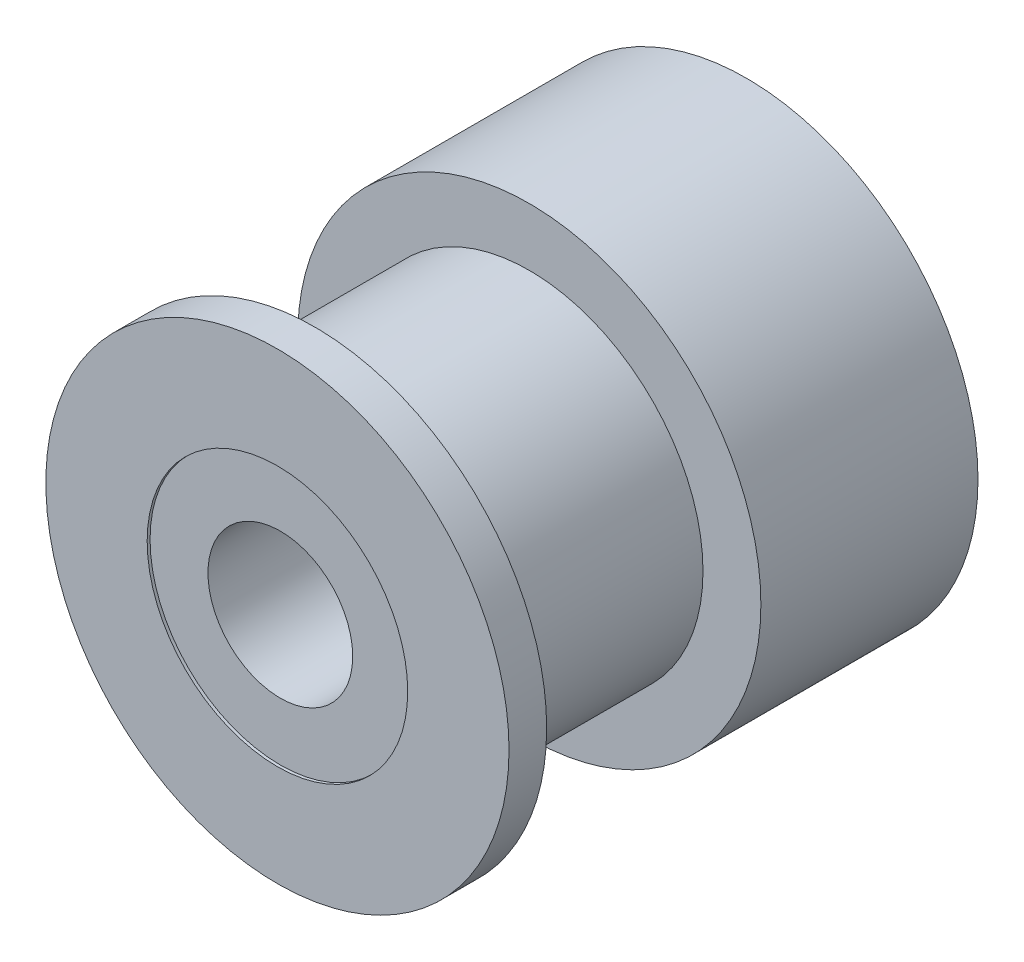
from build123d import *

# Parameters (mm, degrees)
SKETCH1_R           = 8
BOSS_EXTRUDE1_DEPTH = 7.5
SKETCH2_R           = 6
BOSS_EXTRUDE2_DEPTH = 7.4
SKETCH3_R           = 8
BOSS_EXTRUDE3_DEPTH = 1.3
SKETCH4_R           = 2.5
CUT_EXTRUDE1_DEPTH  = 20
SKETCH5_R           = 4.5
CUT_EXTRUDE2_DEPTH  = 0.1
CUT_EXTRUDE3_START  = -0.1
SKETCH6_R           = 4.5
CUT_EXTRUDE3_DEPTH  = 0.1
SKETCH7_R           = 1.5
CUT_EXTRUDE4_DEPTH  = 20
SKETCH8_R           = 1.5
CUT_EXTRUDE5_DEPTH  = 20


with BuildPart() as part:
    # Sketch1 → Boss-Extrude1 (new body)
    with BuildSketch(Plane.XY):
        Circle(SKETCH1_R)
    extrude(amount=BOSS_EXTRUDE1_DEPTH)

    # Sketch2 → Boss-Extrude2 (add)
    with BuildSketch(Plane.XY.offset(7.5)):
        Circle(SKETCH2_R)
    extrude(amount=BOSS_EXTRUDE2_DEPTH)

    # Sketch3 → Boss-Extrude3 (add)
    with BuildSketch(Plane.XY.offset(14.9)):
        Circle(SKETCH3_R)
    extrude(amount=BOSS_EXTRUDE3_DEPTH)

    # Sketch4 → Cut-Extrude1 (cut)
    with BuildSketch(Plane.XY.offset(16.2)):
        Circle(SKETCH4_R)
    extrude(amount=-CUT_EXTRUDE1_DEPTH, mode=Mode.SUBTRACT)

    # Sketch5 → Cut-Extrude2 (cut)
    with BuildSketch(Plane.XY.offset(16.2)):
        Circle(SKETCH5_R)
    extrude(amount=-CUT_EXTRUDE2_DEPTH, mode=Mode.SUBTRACT)

    # Sketch6 → Cut-Extrude3 (cut)
    with BuildSketch(Plane(origin=(0, 0, 0), x_dir=(-1, 0, 0), z_dir=(0, 0, -1)).offset(CUT_EXTRUDE3_START)):
        with Locations(Location((0, 0, 0), (0, 0, 180))):
            Circle(SKETCH6_R)
    extrude(amount=CUT_EXTRUDE3_DEPTH, mode=Mode.SUBTRACT)

    # Sketch7 → Cut-Extrude4 (cut)
    with BuildSketch(Plane(origin=(0, 0, 0), x_dir=(0, 0, -1), z_dir=(1, 0, 0))):
        with Locations((-3.75, 0)):
            Circle(SKETCH7_R)
    extrude(amount=-CUT_EXTRUDE4_DEPTH, mode=Mode.SUBTRACT)

    # Sketch8 → Cut-Extrude5 (cut)
    with BuildSketch(Plane(origin=(0, 0, 0), x_dir=(1, 0, 0), z_dir=(0, 1, 0))):
        with Locations(Location((0, -3.75, 0), (0, 0, 270))):
            Circle(SKETCH8_R)
    extrude(amount=-CUT_EXTRUDE5_DEPTH, mode=Mode.SUBTRACT)


solid = part.part
